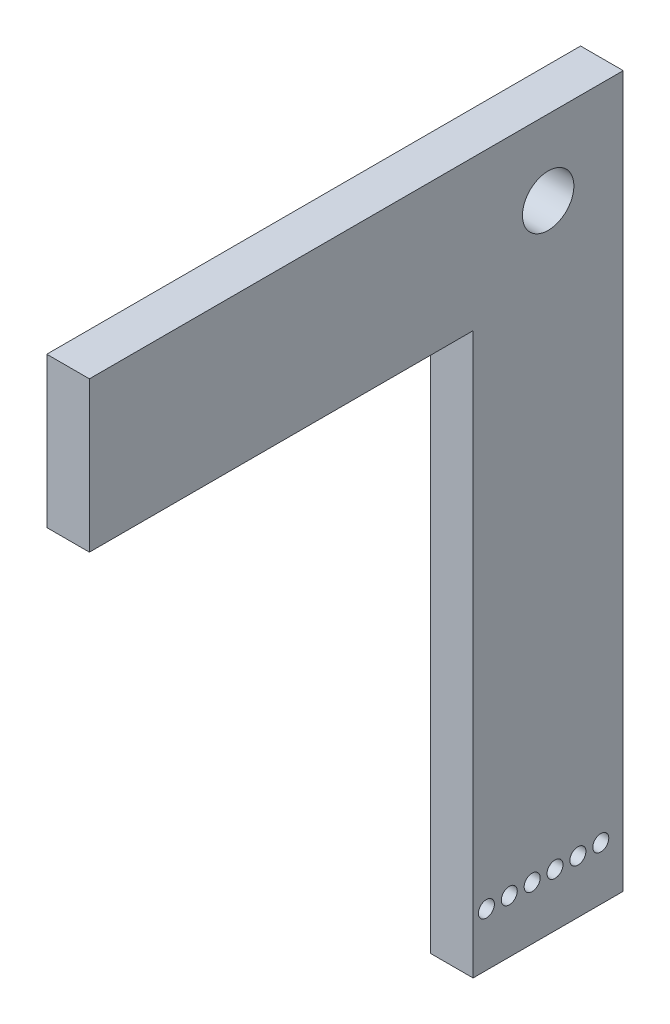
from build123d import *

# Parameters (mm, degrees)
SKETCH1_R           = 2.413
SKETCH1_R_2         = 0.75
BOSS_EXTRUDE1_DEPTH = 2


with BuildPart() as part:
    # Sketch1 → Boss-Extrude1 (new, symmetric)
    with BuildSketch(Plane(origin=(0, 0, 0), x_dir=(0, 0, -1), z_dir=(1, 0, 0))):
        Polygon((-43.032150888, 7.041925615), (7.041925615, 7.041925615), (7.041925615, -59.627321198), (-7.041925615, -59.627321198), (-7.041925615, -7.041925615), (-43.032150888, -7.041925615), align=None)
        Circle(SKETCH1_R, mode=Mode.SUBTRACT)
        with Locations((-5.791925615, -54.627321198)):
            Circle(SKETCH1_R_2, mode=Mode.SUBTRACT)
        with Locations((-3.64647107, -54.627321198)):
            Circle(SKETCH1_R_2, mode=Mode.SUBTRACT)
        with Locations((-1.501016524, -54.627321198)):
            Circle(SKETCH1_R_2, mode=Mode.SUBTRACT)
        with Locations((0.644438021, -54.627321198)):
            Circle(SKETCH1_R_2, mode=Mode.SUBTRACT)
        with Locations((2.789892567, -54.627321198)):
            Circle(SKETCH1_R_2, mode=Mode.SUBTRACT)
        with Locations((4.935347112, -54.627321198)):
            Circle(SKETCH1_R_2, mode=Mode.SUBTRACT)
    extrude(amount=BOSS_EXTRUDE1_DEPTH, both=True)


solid = part.part
